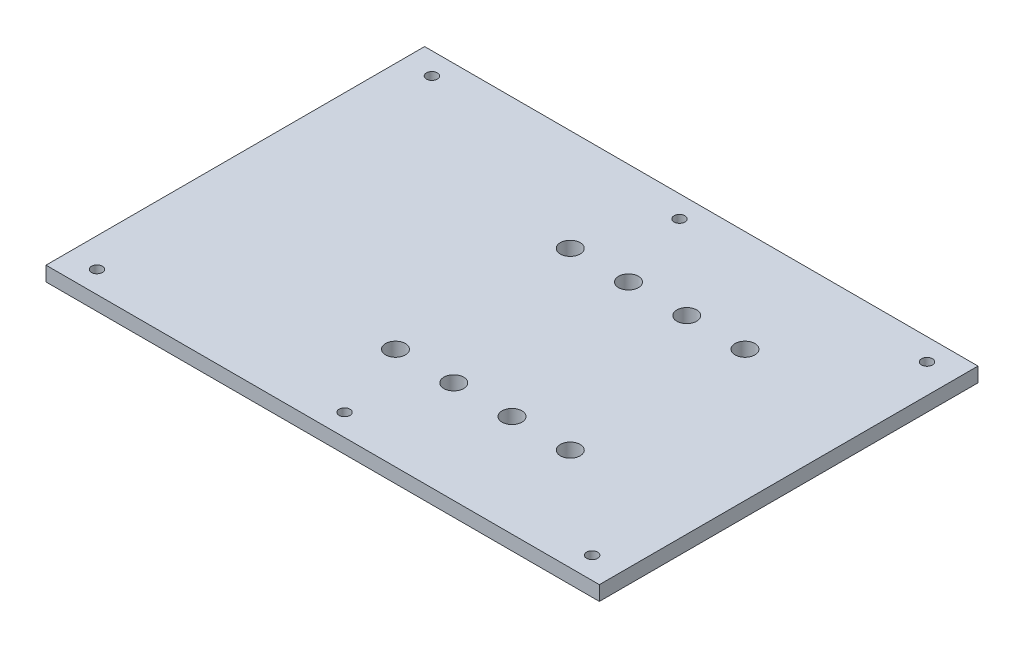
from build123d import *

# Parameters (mm, degrees)
SKETCH1_W               = 482.6
SKETCH1_H               = 330.2
BOSS_EXTRUDE1_DEPTH     = 12.7
CUT_EXTRUDE1_DEPTH      = 293.651652994
CUT_EXTRUDE1_DEPTH_BACK = 293.651652994
SKETCH2_R               = 4.7625
CUT_EXTRUDE2_DEPTH      = 293.651652994
CUT_EXTRUDE2_DEPTH_BACK = 293.651652994
SKETCH4_R               = 8.636


with BuildPart() as part:
    # Sketch1 → Boss-Extrude1 (new body)
    with BuildSketch(Plane(origin=(0, 0, 0), x_dir=(1, 0, 0), z_dir=(0, 1, 0))):
        Rectangle(SKETCH1_W, SKETCH1_H)
    extrude(amount=BOSS_EXTRUDE1_DEPTH)

    # Sketch2 → Cut-Extrude1 (cut, two sides: drawn at the far end of the back side and taken through both)
    with BuildSketch(Plane(origin=(0, 12.7, 0), x_dir=(1, 0, 0), z_dir=(0, 1, 0)).offset(-CUT_EXTRUDE1_DEPTH_BACK)):
        with Locations(Location((215.9, 146.05, 0), (0, 0, 270))):
            Circle(SKETCH2_R)
        with Locations(Location((-215.9, 146.05, 0), (0, 0, 270))):
            Circle(SKETCH2_R)
        with Locations(Location((215.9, -146.05, 0), (0, 0, 270))):
            Circle(SKETCH2_R)
        with Locations(Location((-215.9, -146.05, 0), (0, 0, 270))):
            Circle(SKETCH2_R)
        with Locations(Location((0, 146.05, 0), (0, 0, 270))):
            Circle(SKETCH2_R)
        with Locations(Location((0, -146.05, 0), (0, 0, 270))):
            Circle(SKETCH2_R)
    extrude(amount=CUT_EXTRUDE1_DEPTH + CUT_EXTRUDE1_DEPTH_BACK, mode=Mode.SUBTRACT)

    # Sketch4 → Cut-Extrude2 (cut, two sides: drawn at the far end of the back side and taken through both)
    with BuildSketch(Plane(origin=(0, 12.7, 0), x_dir=(1, 0, 0), z_dir=(0, 1, 0)).offset(-CUT_EXTRUDE2_DEPTH_BACK)):
        with Locations(Location((-25.4, 76.2, 0), (0, 0, 270))):
            Circle(SKETCH4_R)
        with Locations(Location((25.4, 76.2, 0), (0, 0, 270))):
            Circle(SKETCH4_R)
        with Locations(Location((76.2, 76.2, 0), (0, 0, 270))):
            Circle(SKETCH4_R)
        with Locations(Location((127, 76.2, 0), (0, 0, 270))):
            Circle(SKETCH4_R)
        with Locations(Location((127, -76.2, 0), (0, 0, 270))):
            Circle(SKETCH4_R)
        with Locations(Location((76.2, -76.2, 0), (0, 0, 270))):
            Circle(SKETCH4_R)
        with Locations(Location((25.4, -76.2, 0), (0, 0, 270))):
            Circle(SKETCH4_R)
        with Locations(Location((-25.4, -76.2, 0), (0, 0, 270))):
            Circle(SKETCH4_R)
    extrude(amount=CUT_EXTRUDE2_DEPTH + CUT_EXTRUDE2_DEPTH_BACK, mode=Mode.SUBTRACT)


solid = part.part
